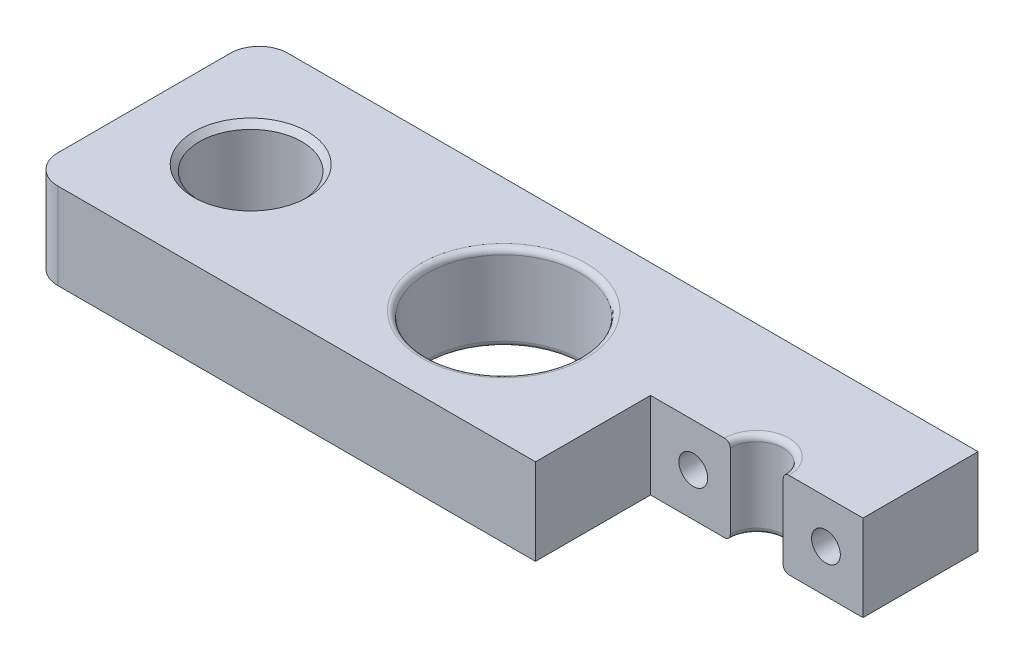
from build123d import *

# Parameters (mm, degrees)
SKETCH_1_W          = 125
SKETCH_1_H          = 40
EXTRUDE_1_DEPTH     = 15
SKETCH_2_R          = 8.9
SKETCH_2_R_2        = 4.6
SKETCH_2_R_3        = 13.3
CUT_EXTRUDE_1_DEPTH = 133.098448136
CHAMFER_1_SIZE      = 1
CHAMFER_2_SIZE      = 1
FILLET_1_R          = 1
SKETCH_5_W          = 40
SKETCH_5_H          = 20
CUT_EXTRUDE_2_DEPTH = 133.098448148
FILLET_4_R          = 5
SKETCH_12_W         = 3.06
SKETCH_12_H         = 20
EXTRUDE_2_DEPTH     = 15
SKETCH_14_R         = 2.5
CUT_EXTRUDE_3_DEPTH = 128.47548784


with BuildPart() as part:
    # 草圖1 → 填料-伸長1 (new body)
    with BuildSketch(Plane(origin=(0, 0, 0), x_dir=(1, 0, 0), z_dir=(0, 1, 0))):
        with Locations((62.5, 20)):
            Rectangle(SKETCH_1_W, SKETCH_1_H)
    extrude(amount=EXTRUDE_1_DEPTH)

    # 草圖2 → 除料-伸長1 (cut, through all)
    with BuildSketch(Plane(origin=(0, 15, 0), x_dir=(1, 0, 0), z_dir=(0, 1, 0))):
        with Locations(Location((18.526668527, 20, 0), (0, 0, 270))):
            Circle(SKETCH_2_R)
        with Locations(Location((106.526668527, 20, 0), (0, 0, 270))):
            Circle(SKETCH_2_R_2)
        with Locations(Location((62.526668527, 20, 0), (0, 0, 270))):
            Circle(SKETCH_2_R_3)
    extrude(amount=-CUT_EXTRUDE_1_DEPTH, mode=Mode.SUBTRACT)

    # 導角1
    chamfer_1_edges = [part.edges().sort_by_distance(p)[0] for p in [
        (18.526668527, 15, -28.9),
    ]]
    chamfer(chamfer_1_edges, length=CHAMFER_1_SIZE)

    # 導角2
    chamfer_2_edges = [part.edges().sort_by_distance(p)[0] for p in [
        (18.526668527, 0, -28.9),
    ]]
    chamfer(chamfer_2_edges, length=CHAMFER_2_SIZE)

    # 圓角1
    fillet_1_edges = [part.edges().sort_by_distance(p)[0] for p in [
        (106.526668527, 0, -24.6),
        (106.526668527, 15, -24.6),
        (62.526668527, 0, -33.3),
        (62.526668527, 15, -33.3),
    ]]
    fillet(fillet_1_edges, radius=FILLET_1_R)

    # 草圖5 → 除料-伸長2 (cut, through all)
    with BuildSketch(Plane(origin=(0, 15, 0), x_dir=(1, 0, 0), z_dir=(0, 1, 0))):
        with Locations((105, 10)):
            Rectangle(SKETCH_5_W, SKETCH_5_H)
    extrude(amount=-CUT_EXTRUDE_2_DEPTH, mode=Mode.SUBTRACT)

    # 圓角4
    fillet_4_edges = [part.edges().sort_by_distance(p)[0] for p in [
        (0, 7.5, -40),
        (0, 7.5, 0),
    ]]
    fillet(fillet_4_edges, radius=FILLET_4_R)

    # 草圖12 → 填料-伸長2 (add)
    with BuildSketch(Plane(origin=(0, 15, 0), x_dir=(1, 0, 0), z_dir=(0, 1, 0))):
        with Locations((86.53, 10)):
            Rectangle(SKETCH_12_W, SKETCH_12_H)
    extrude(amount=-EXTRUDE_2_DEPTH)

    # 草圖14 → 除料-伸長3 (cut, through all)
    with BuildSketch(Plane.XY.offset(-20)):
        with Locations((118.565, 7.5)):
            Circle(SKETCH_14_R)
        with Locations((95.491668527, 7.5)):
            Circle(SKETCH_14_R)
    extrude(amount=-CUT_EXTRUDE_3_DEPTH, mode=Mode.SUBTRACT)


solid = part.part
